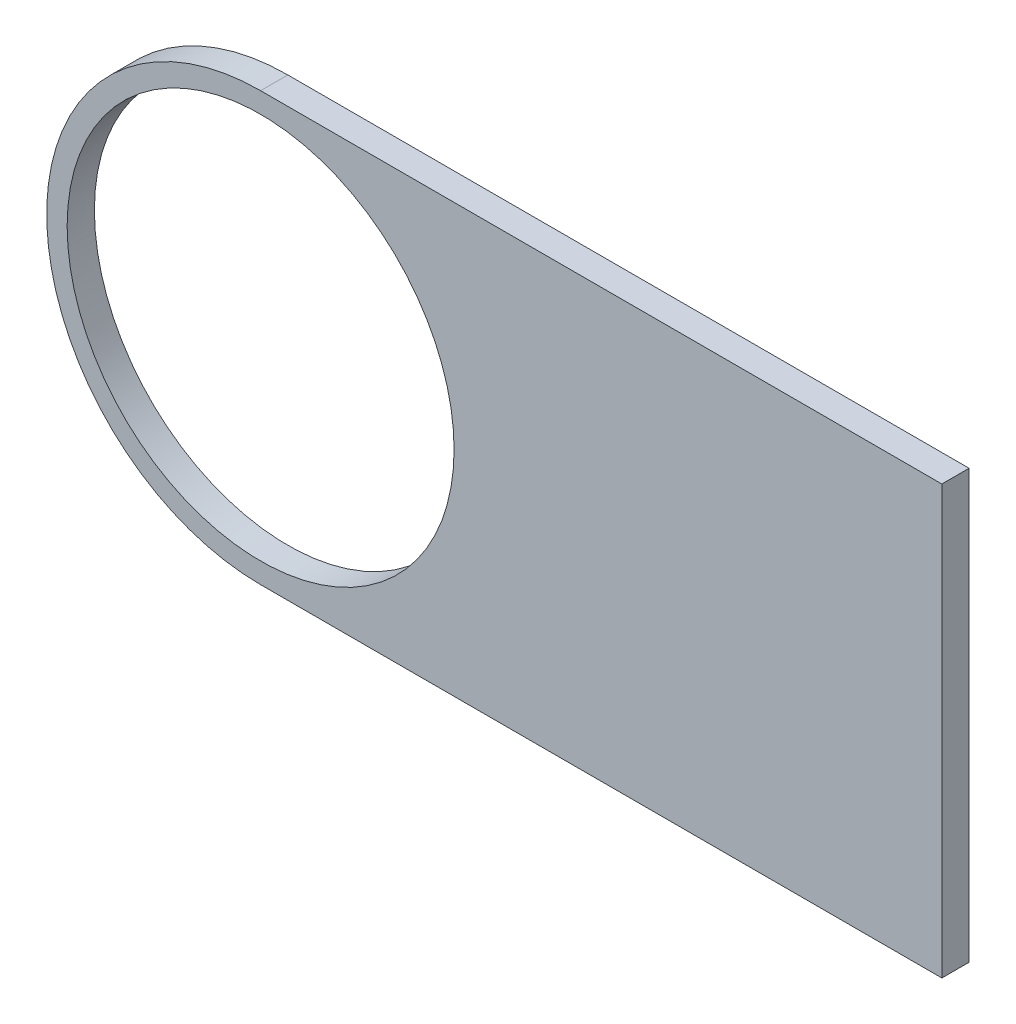
from build123d import *

# Parameters (mm, degrees)
SKETCH1_R           = 19.939
BOSS_EXTRUDE1_DEPTH = 2.54
SKETCH3_W           = 2.54
SKETCH3_H           = 39.878
BOSS_EXTRUDE2_DEPTH = 63.5
SKETCH2_R           = 18.034
CUT_EXTRUDE1_DEPTH  = 2.54


with BuildPart() as part:
    # Sketch1 → Boss-Extrude1 (new body)
    with BuildSketch(Plane.XY):
        Circle(SKETCH1_R)
    extrude(amount=BOSS_EXTRUDE1_DEPTH)

    # Sketch3 → Boss-Extrude2 (add)
    with BuildSketch(Plane(origin=(0, 0, 0), x_dir=(0, 0, -1), z_dir=(1, 0, 0))):
        with Locations((-1.27, 0)):
            Rectangle(SKETCH3_W, SKETCH3_H)
    extrude(amount=BOSS_EXTRUDE2_DEPTH)

    # Sketch2 → Cut-Extrude1 (cut)
    with BuildSketch(Plane.XY.offset(2.54)):
        Circle(SKETCH2_R)
    extrude(amount=-CUT_EXTRUDE1_DEPTH, mode=Mode.SUBTRACT)


solid = part.part
